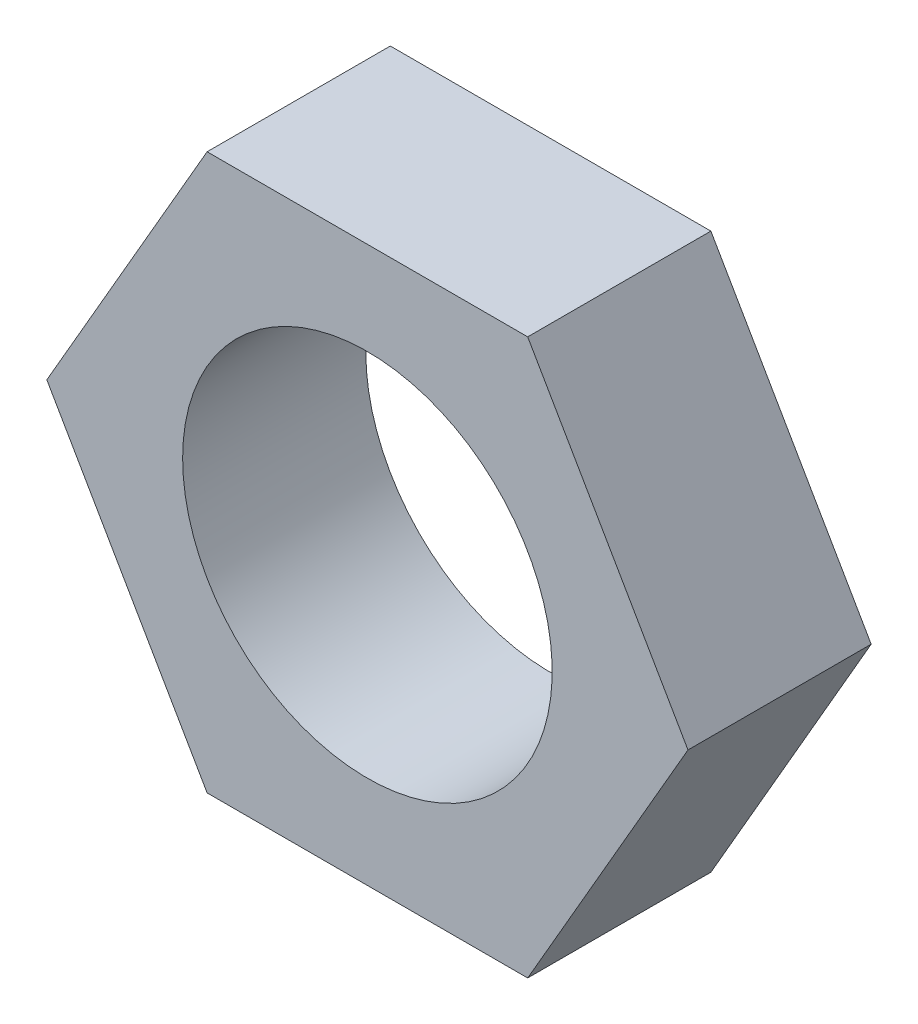
from build123d import *

# Parameters (mm, degrees)
BOSS_EXTRUDE1_DEPTH = 12.7
SKETCH2_R           = 12.810731211
CUT_EXTRUDE1_DEPTH  = 12.7


with BuildPart() as part:
    # Sketch1 → Boss-Extrude1 (new body)
    with BuildSketch(Plane.XY):
        Polygon((22.225, 0), (11.1125, 19.247414599), (-11.1125, 19.247414599), (-22.225, 0), (-11.1125, -19.247414599), (11.1125, -19.247414599), align=None)
    extrude(amount=BOSS_EXTRUDE1_DEPTH)

    # Sketch2 → Cut-Extrude1 (cut)
    with BuildSketch(Plane(origin=(0, 0, 0), x_dir=(-1, 0, 0), z_dir=(0, 0, -1))):
        Circle(SKETCH2_R)
    extrude(amount=-CUT_EXTRUDE1_DEPTH, mode=Mode.SUBTRACT)


solid = part.part
